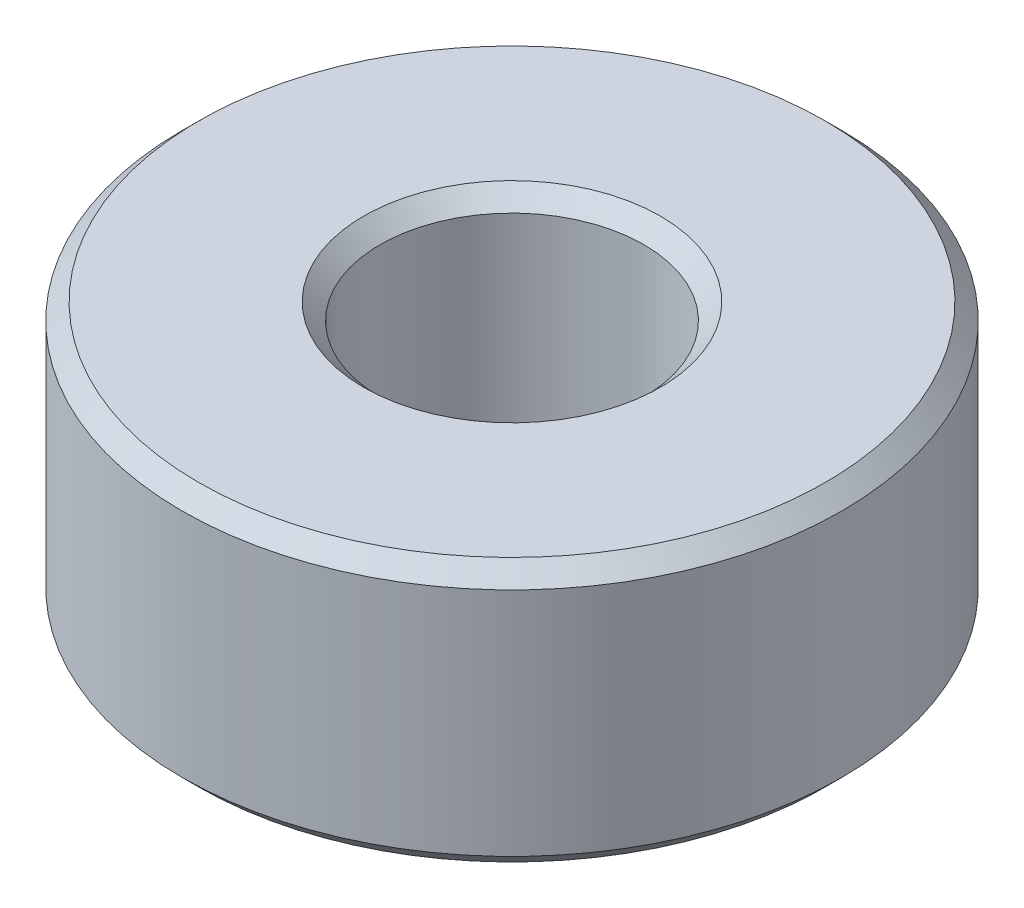
from build123d import *

# Parameters (mm, degrees)
SKETCH1_R           = 2.5
SKETCH1_R_2         = 1
BOSS_EXTRUDE1_DEPTH = 2
CHAMFER1_SIZE       = 0.125


with BuildPart() as part:
    # Sketch1 → Boss-Extrude1 (new body)
    with BuildSketch(Plane(origin=(0, 0, 0), x_dir=(1, 0, 0), z_dir=(0, 1, 0))):
        with Locations(Location((0, 0, 0), (0, 0, 270))):
            Circle(SKETCH1_R)
        with Locations(Location((0, 0, 0), (0, 0, 270))):
            Circle(SKETCH1_R_2, mode=Mode.SUBTRACT)
    extrude(amount=BOSS_EXTRUDE1_DEPTH)

    # Chamfer1
    chamfer1_edges = [part.edges().sort_by_distance(p)[0] for p in [
        (0, 0, -2.5),
        (0, 2, -2.5),
        (0, 0, -1),
        (0, 2, -1),
    ]]
    chamfer(chamfer1_edges, length=CHAMFER1_SIZE)


solid = part.part
